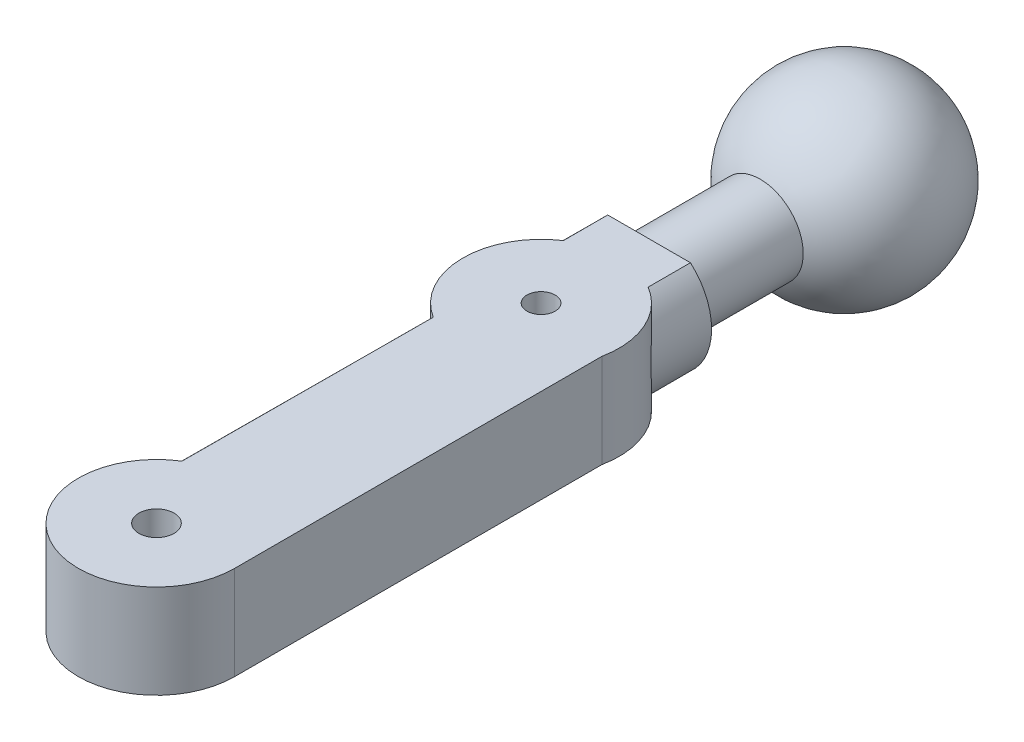
from build123d import *
from build123d.topology import SkipClean

# Parameters (mm, degrees)
SKETCH_2_R                        = 1.1
EXTRUDE_1_DEPTH                   = 17.6064
CUT_EXTRUDE_1_DEPTH               = 18.93594504
CUT_EXTRUDE_1_DEPTH_BACK          = 18.93594504
SKETCH_3_R                        = 2
SKETCH_3_3_R                      = 2
SKETCH_3_3_R_2                    = 0.45
EXTRUDE_2_DEPTH                   = 1.2
EXTRUDE_8_REACH                   = 22.084
SKETCH_7_R                        = 2
SKETCH_7_R_2                      = 0.36
EXTRUDE_9_REACH                   = 17.744
EXTRUDE_9_END_RADIUS              = 2
EXTRUDE_9_DIRECTION_2_REACH       = 17.744
EXTRUDE_9_DIRECTION_2_END_RADIUS  = 2
SKETCH_11_R                       = 0.36
CUT_EXTRUDE_2_DEPTH               = 21.084116234
EXTRUDE_10_REACH                  = 14.883
EXTRUDE_10_END_RADIUS             = 2
EXTRUDE_10_DIRECTION_2_REACH      = 14.883
EXTRUDE_10_DIRECTION_2_END_RADIUS = 2
EXTRUDE_11_REACH                  = 17.002
EXTRUDE_11_END_RADIUS             = 2
SKETCH_13_R                       = 1.6
SKETCH_14_W                       = 7.40434877
SKETCH_14_H                       = 4.06336213
CUT_EXTRUDE_3_DEPTH               = 21.084116234
SKETCH_15_W                       = 5.898333764
SKETCH_15_H                       = 3.047472445
CUT_EXTRUDE_4_DEPTH               = 21.084116234


with BuildPart() as part:
    # 草图1 → 旋转1 (revolve)
    with SkipClean():  # the faces are left unmerged after this step: merging them gives an invalid solid
        with BuildSketch(Plane.XY):
            with BuildLine():
                ThreePointArc((2.42, 0), (1.71119841, 1.71119841), (0, 2.42))
                Line((0, 2.42), (0, -2.42))
                ThreePointArc((0, -2.42), (1.71119841, -1.71119841), (2.42, 0))
            make_face()
            with BuildLine():
                Line((0, -2.42), (0, 2.42))
                ThreePointArc((0, 2.42), (-2.42, 0), (0, -2.42))
            make_face()
        revolve(axis=Axis((0, 2.42, 0), (0, -1, 0)))

    # 草图2 → 凸台-拉伸1 (add)
    with SkipClean():  # the faces are left unmerged after this step: merging them gives an invalid solid
        with BuildSketch(Plane.XY):
            with Locations(Location((0, 0, 0), (0, 0, 180))):
                Circle(SKETCH_2_R)
        extrude(amount=EXTRUDE_1_DEPTH)

    # 草图3 → 切除-拉伸1 (cut, two sides: drawn at the far end of the back side and taken through both)
    with SkipClean():  # the faces are left unmerged after this step: merging them gives an invalid solid
        with BuildSketch(Plane(origin=(0, 0, 0), x_dir=(1, 0, 0), z_dir=(0, 1, 0)).offset(-CUT_EXTRUDE_1_DEPTH_BACK)):
            with Locations((0, -17.6064)):
                Circle(SKETCH_3_R)
        extrude(amount=CUT_EXTRUDE_1_DEPTH + CUT_EXTRUDE_1_DEPTH_BACK, mode=Mode.SUBTRACT)

    # 草图3<3> → 凸台-拉伸2 (add, symmetric)
    with SkipClean():  # the faces are left unmerged after this step: merging them gives an invalid solid
        with BuildSketch(Plane(origin=(0, 0, 0), x_dir=(1, 0, 0), z_dir=(0, 1, 0))):
            with Locations(Location((0, -17.6064, 0), (0, 0, 270))):
                Circle(SKETCH_3_3_R)
            with Locations(Location((0, -17.6064, 0), (0, 0, 270))):
                Circle(SKETCH_3_3_R_2, mode=Mode.SUBTRACT)
        extrude(amount=EXTRUDE_2_DEPTH, both=True)

    # 凸台-拉伸8: up to this face of the body (flat: up to its plane)
    extrude_8_end = Plane(part.part.faces().sort_by_distance((0, -1.2, 15.662968542))[0])
    # 草图7 → 凸台-拉伸8 (add, up to the picked face)
    with BuildSketch(Plane(origin=(0, 1.2, 0), x_dir=(1, 0, 0), z_dir=(0, 1, 0)), mode=Mode.PRIVATE) as extrude_8_sk1:
        with Locations(Location((0.041050024, -7.806485975, 0), (0, 0, 270))):
            Circle(SKETCH_7_R)
        with Locations(Location((0.041050024, -7.806485975, 0), (0, 0, 270))):
            Circle(SKETCH_7_R_2, mode=Mode.SUBTRACT)
    extrude_8_tool1 = split(extrude(extrude_8_sk1.sketch, amount=-EXTRUDE_8_REACH, mode=Mode.PRIVATE), bisect_by=extrude_8_end, keep=Keep.BOTH, mode=Mode.PRIVATE)
    add(extrude_8_tool1.solids().sort_by(Axis((0.04105, 1.2, 5.863055), (0, -1, 0)))[0])

    # 凸台-拉伸9: up to this cylinder (the profile starts outside it)
    with SkipClean():  # the faces are left unmerged after this step: merging them gives an invalid solid
        extrude_9_end = Plane(origin=(0.041050024, 0, 7.806485975), z_dir=(0, 1, 0)) * Cylinder(EXTRUDE_9_END_RADIUS, 40.488, mode=Mode.PRIVATE)
        # 草图10 → 凸台-拉伸9 (add, up to the surface)
        with BuildSketch(Plane(origin=(0.020525012, 1.2, 12.706442988), x_dir=(-0.9999912270311377, 0, -0.0041887779554037885), z_dir=(0.0041887779554037885, 0, -0.9999912270311377)), mode=Mode.PRIVATE) as extrude_9_sk1:
            with BuildLine():
                Line((1.058300524, 0), (0, 0))
                Line((0, 0), (0, -2.4))
                Line((0, -2.4), (1.058300524, -2.4))
                ThreePointArc((1.058300524, -2.4), (1.458300524, -1.858300524), (1.6, -1.2))
                ThreePointArc((1.6, -1.2), (1.458300524, -0.541699476), (1.058300524, 0))
            make_face()
        extrude_9_tool1 = extrude(extrude_9_sk1.sketch, amount=EXTRUDE_9_REACH, mode=Mode.PRIVATE) - extrude_9_end
        add(extrude_9_tool1.solids().sort_by_distance((-0.704839, 0, 12.703405))[0])
        # 草图10 → 凸台-拉伸9 (add, up to the surface)
        with BuildSketch(Plane(origin=(0.020525012, 1.2, 12.706442988), x_dir=(-0.9999912270311377, 0, -0.0041887779554037885), z_dir=(0.0041887779554037885, 0, -0.9999912270311377)), mode=Mode.PRIVATE) as extrude_9_sk2:
            with BuildLine():
                Line((0, -2.4), (0, 0))
                Line((0, 0), (-1.058300524, 0))
                ThreePointArc((-1.058300524, 0), (-1.6, -1.2), (-1.058300524, -2.4))
                Line((-1.058300524, -2.4), (0, -2.4))
            make_face()
        extrude_9_tool2 = extrude(extrude_9_sk2.sketch, amount=EXTRUDE_9_REACH, mode=Mode.PRIVATE) - extrude_9_end
        add(extrude_9_tool2.solids().sort_by_distance((0.745889, 0, 12.709481))[0])
        # 草图10 → 凸台-拉伸9 (add, up to the surface)
        with BuildSketch(Plane(origin=(0.020525012, 1.2, 12.706442988), x_dir=(-0.9999912270311377, 0, -0.0041887779554037885), z_dir=(0.0041887779554037885, 0, -0.9999912270311377)), mode=Mode.PRIVATE) as extrude_9_sk3:
            with BuildLine():
                Line((1.058300524, 0), (0, 0))
                Line((0, 0), (0, -2.4))
                Line((0, -2.4), (1.058300524, -2.4))
                ThreePointArc((1.058300524, -2.4), (1.458300524, -1.858300524), (1.6, -1.2))
                ThreePointArc((1.6, -1.2), (1.458300524, -0.541699476), (1.058300524, 0))
            make_face()
        extrude_9_tool3 = extrude(extrude_9_sk3.sketch, amount=EXTRUDE_9_REACH, mode=Mode.PRIVATE) - extrude_9_end
        add(extrude_9_tool3.solids().sort_by_distance((-0.704839, 0, 12.703405))[0])
        # 草图10 → 凸台-拉伸9 (add, up to the surface)
        with BuildSketch(Plane(origin=(0.020525012, 1.2, 12.706442988), x_dir=(-0.9999912270311377, 0, -0.0041887779554037885), z_dir=(0.0041887779554037885, 0, -0.9999912270311377)), mode=Mode.PRIVATE) as extrude_9_sk4:
            with BuildLine():
                Line((0, -2.4), (0, 0))
                Line((0, 0), (-1.058300524, 0))
                ThreePointArc((-1.058300524, 0), (-1.6, -1.2), (-1.058300524, -2.4))
                Line((-1.058300524, -2.4), (0, -2.4))
            make_face()
        extrude_9_tool4 = extrude(extrude_9_sk4.sketch, amount=EXTRUDE_9_REACH, mode=Mode.PRIVATE) - extrude_9_end
        add(extrude_9_tool4.solids().sort_by_distance((0.745889, 0, 12.709481))[0])

    # 凸台-拉伸9 direction 2: up to this cylinder (the profile starts outside it)
    with SkipClean():  # the faces are left unmerged after this step: merging them gives an invalid solid
        extrude_9_direction_2_end = Plane(origin=(0, 0, 17.6064), z_dir=(0, -1, 0)) * Cylinder(EXTRUDE_9_DIRECTION_2_END_RADIUS, 40.488, mode=Mode.PRIVATE)
        # 草图10 → 凸台-拉伸9 direction 2 (add, up to the surface)
        with BuildSketch(Plane(origin=(0.020525012, 1.2, 12.706442988), x_dir=(-0.9999912270311377, 0, -0.0041887779554037885), z_dir=(0.0041887779554037885, 0, -0.9999912270311377)), mode=Mode.PRIVATE) as extrude_9_direction_2_sk1:
            with BuildLine():
                Line((1.058300524, 0), (0, 0))
                Line((0, 0), (0, -2.4))
                Line((0, -2.4), (1.058300524, -2.4))
                ThreePointArc((1.058300524, -2.4), (1.458300524, -1.858300524), (1.6, -1.2))
                ThreePointArc((1.6, -1.2), (1.458300524, -0.541699476), (1.058300524, 0))
            make_face()
        extrude_9_direction_2_tool1 = extrude(extrude_9_direction_2_sk1.sketch, amount=-EXTRUDE_9_DIRECTION_2_REACH, mode=Mode.PRIVATE) - extrude_9_direction_2_end
        add(extrude_9_direction_2_tool1.solids().sort_by_distance((-0.704839, 0, 12.703405))[0])
        # 草图10 → 凸台-拉伸9 direction 2 (add, up to the surface)
        with BuildSketch(Plane(origin=(0.020525012, 1.2, 12.706442988), x_dir=(-0.9999912270311377, 0, -0.0041887779554037885), z_dir=(0.0041887779554037885, 0, -0.9999912270311377)), mode=Mode.PRIVATE) as extrude_9_direction_2_sk2:
            with BuildLine():
                Line((0, -2.4), (0, 0))
                Line((0, 0), (-1.058300524, 0))
                ThreePointArc((-1.058300524, 0), (-1.6, -1.2), (-1.058300524, -2.4))
                Line((-1.058300524, -2.4), (0, -2.4))
            make_face()
        extrude_9_direction_2_tool2 = extrude(extrude_9_direction_2_sk2.sketch, amount=-EXTRUDE_9_DIRECTION_2_REACH, mode=Mode.PRIVATE) - extrude_9_direction_2_end
        add(extrude_9_direction_2_tool2.solids().sort_by_distance((0.745889, 0, 12.709481))[0])
        # 草图10 → 凸台-拉伸9 direction 2 (add, up to the surface)
        with BuildSketch(Plane(origin=(0.020525012, 1.2, 12.706442988), x_dir=(-0.9999912270311377, 0, -0.0041887779554037885), z_dir=(0.0041887779554037885, 0, -0.9999912270311377)), mode=Mode.PRIVATE) as extrude_9_direction_2_sk3:
            with BuildLine():
                Line((1.058300524, 0), (0, 0))
                Line((0, 0), (0, -2.4))
                Line((0, -2.4), (1.058300524, -2.4))
                ThreePointArc((1.058300524, -2.4), (1.458300524, -1.858300524), (1.6, -1.2))
                ThreePointArc((1.6, -1.2), (1.458300524, -0.541699476), (1.058300524, 0))
            make_face()
        extrude_9_direction_2_tool3 = extrude(extrude_9_direction_2_sk3.sketch, amount=-EXTRUDE_9_DIRECTION_2_REACH, mode=Mode.PRIVATE) - extrude_9_direction_2_end
        add(extrude_9_direction_2_tool3.solids().sort_by_distance((-0.704839, 0, 12.703405))[0])
        # 草图10 → 凸台-拉伸9 direction 2 (add, up to the surface)
        with BuildSketch(Plane(origin=(0.020525012, 1.2, 12.706442988), x_dir=(-0.9999912270311377, 0, -0.0041887779554037885), z_dir=(0.0041887779554037885, 0, -0.9999912270311377)), mode=Mode.PRIVATE) as extrude_9_direction_2_sk4:
            with BuildLine():
                Line((0, -2.4), (0, 0))
                Line((0, 0), (-1.058300524, 0))
                ThreePointArc((-1.058300524, 0), (-1.6, -1.2), (-1.058300524, -2.4))
                Line((-1.058300524, -2.4), (0, -2.4))
            make_face()
        extrude_9_direction_2_tool4 = extrude(extrude_9_direction_2_sk4.sketch, amount=-EXTRUDE_9_DIRECTION_2_REACH, mode=Mode.PRIVATE) - extrude_9_direction_2_end
        add(extrude_9_direction_2_tool4.solids().sort_by_distance((0.745889, 0, 12.709481))[0])

    # 草图11 → 切除-拉伸2 (cut, through all)
    with SkipClean():  # the faces are left unmerged after this step: merging them gives an invalid solid
        with BuildSketch(Plane(origin=(0, 1.2, 0), x_dir=(1, 0, 0), z_dir=(0, 1, 0))):
            with Locations(Location((0.041050024, -7.806485975, 0), (0, 0, 270))):
                Circle(SKETCH_11_R)
        extrude(amount=-CUT_EXTRUDE_2_DEPTH, mode=Mode.SUBTRACT)

    # 凸台-拉伸10: up to this cylinder (the profile starts outside it)
    with SkipClean():  # the faces are left unmerged after this step: merging them gives an invalid solid
        extrude_10_end = Plane(origin=(0.041050024, 0, 7.806485975), z_dir=(0, 1, 0)) * Cylinder(EXTRUDE_10_END_RADIUS, 34.766, mode=Mode.PRIVATE)
        # 草图12 → 凸台-拉伸10 (add, up to the surface)
        with BuildSketch(Plane.XY.offset(10), mode=Mode.PRIVATE) as extrude_10_sk1:
            Polygon((0, 0), (0, 1.2), (2, 1.2), (2, -1.2), (0, -1.2), align=None)
        extrude_10_tool1 = extrude(extrude_10_sk1.sketch, amount=-EXTRUDE_10_REACH, mode=Mode.PRIVATE) - extrude_10_end
        add(extrude_10_tool1.solids().sort_by_distance((1, 0, 10))[0])

    # 凸台-拉伸10 direction 2: up to this cylinder (the profile starts outside it)
    with SkipClean():  # the faces are left unmerged after this step: merging them gives an invalid solid
        extrude_10_direction_2_end = Plane(origin=(0, 0, 17.6064), z_dir=(0, -1, 0)) * Cylinder(EXTRUDE_10_DIRECTION_2_END_RADIUS, 34.766, mode=Mode.PRIVATE)
        # 草图12 → 凸台-拉伸10 direction 2 (add, up to the surface)
        with BuildSketch(Plane.XY.offset(10), mode=Mode.PRIVATE) as extrude_10_direction_2_sk1:
            Polygon((0, 0), (0, 1.2), (2, 1.2), (2, -1.2), (0, -1.2), align=None)
        extrude_10_direction_2_tool1 = extrude(extrude_10_direction_2_sk1.sketch, amount=EXTRUDE_10_DIRECTION_2_REACH, mode=Mode.PRIVATE) - extrude_10_direction_2_end
        add(extrude_10_direction_2_tool1.solids().sort_by_distance((1, 0, 10))[0])

    # 凸台-拉伸11: up to this cylinder (the profile starts outside it)
    with SkipClean():  # the faces are left unmerged after this step: merging them gives an invalid solid
        extrude_11_end = Plane(origin=(0.041050024, 0, 7.806485975), z_dir=(0, 1, 0)) * Cylinder(EXTRUDE_11_END_RADIUS, 39.004, mode=Mode.PRIVATE)
        # 草图13 → 凸台-拉伸11 (add, up to the surface)
        with BuildSketch(Plane.XY.offset(5), mode=Mode.PRIVATE) as extrude_11_sk1:
            with Locations(Location((0, 0, 0), (0, 0, 131.409594385))):
                Circle(SKETCH_13_R)
        extrude_11_tool1 = extrude(extrude_11_sk1.sketch, amount=EXTRUDE_11_REACH, mode=Mode.PRIVATE) - extrude_11_end
        add(extrude_11_tool1.solids().sort_by_distance((0, 0, 5))[0])

    # 草图14 → 切除-拉伸3 (cut, through all)
    with SkipClean():  # the faces are left unmerged after this step: merging them gives an invalid solid
        with BuildSketch(Plane(origin=(0, 1.2, 0), x_dir=(1, 0, 0), z_dir=(0, 1, 0))):
            with Locations((0.094582813, -5.966785927)):
                Rectangle(SKETCH_14_W, SKETCH_14_H)
        extrude(amount=CUT_EXTRUDE_3_DEPTH, mode=Mode.SUBTRACT)

    # 草图15 → 切除-拉伸4 (cut, through all)
    with SkipClean():  # the faces are left unmerged after this step: merging them gives an invalid solid
        with BuildSketch(Plane.XZ.offset(1.2)):
            with Locations((0.081921302, 5.906181286)):
                Rectangle(SKETCH_15_W, SKETCH_15_H)
        extrude(amount=CUT_EXTRUDE_4_DEPTH, mode=Mode.SUBTRACT)


solid = part.part
